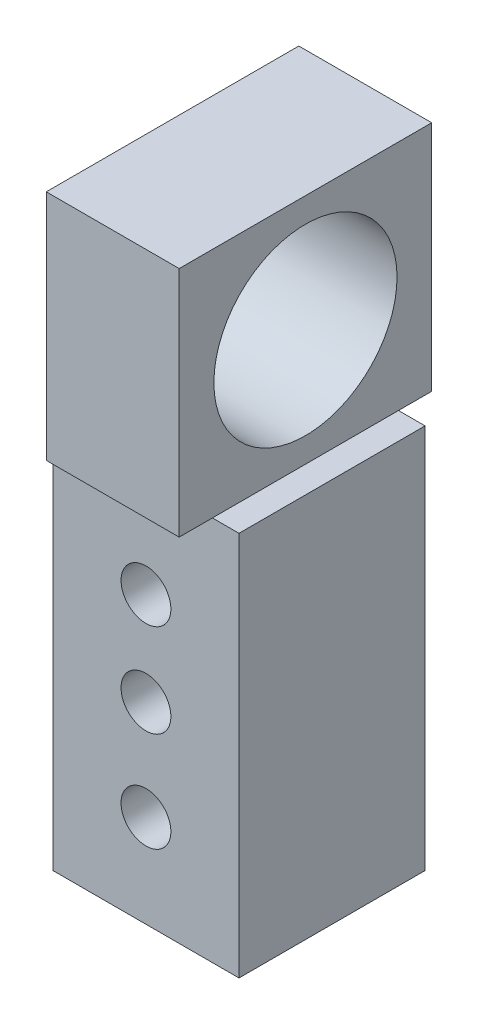
from build123d import *

# Parameters (mm, degrees)
SKETCH1_W           = 35.56
SKETCH1_H           = 35.56
BOSS_EXTRUDE1_DEPTH = 73.5965
SKETCH2_R           = 4.7625
CUT_EXTRUDE1_DEPTH  = 84.648591215
SKETCH3_W           = 25.4
SKETCH3_H           = 35.56
BOSS_EXTRUDE2_DEPTH = 44.45
SKETCH5_W           = 25.4
SKETCH5_H           = 44.45
BOSS_EXTRUDE3_DEPTH = 6.35
SKETCH6_W           = 25.4
SKETCH6_H           = 44.45
BOSS_EXTRUDE4_DEPTH = 6.35
SKETCH4_R           = 17.500000052
CUT_EXTRUDE2_DEPTH  = 84.232998938


with BuildPart() as part:
    # Sketch1 → Boss-Extrude1 (new body)
    with BuildSketch(Plane(origin=(0, 0, 0), x_dir=(1, 0, 0), z_dir=(0, 1, 0))):
        Rectangle(SKETCH1_W, SKETCH1_H)
    extrude(amount=-BOSS_EXTRUDE1_DEPTH)

    # Sketch2 → Cut-Extrude1 (cut, through all)
    with BuildSketch(Plane.XY.offset(17.78)):
        with Locations((0, -19.05)):
            Circle(SKETCH2_R)
        with Locations((0, -36.83)):
            Circle(SKETCH2_R)
        with Locations((0, -55.88)):
            Circle(SKETCH2_R)
    extrude(amount=-CUT_EXTRUDE1_DEPTH, mode=Mode.SUBTRACT)

    # Sketch3 → Boss-Extrude2 (add)
    with BuildSketch(Plane(origin=(0, 0, 0), x_dir=(1, 0, 0), z_dir=(0, 1, 0))):
        Rectangle(SKETCH3_W, SKETCH3_H)
    extrude(amount=BOSS_EXTRUDE2_DEPTH)

    # Sketch5 → Boss-Extrude3 (add)
    with BuildSketch(Plane.XY.offset(17.78)):
        with Locations((0, 22.225)):
            Rectangle(SKETCH5_W, SKETCH5_H)
    extrude(amount=BOSS_EXTRUDE3_DEPTH)

    # Sketch6 → Boss-Extrude4 (add)
    with BuildSketch(Plane(origin=(0, 0, -17.78), x_dir=(-1, 0, 0), z_dir=(0, 0, -1))):
        with Locations((0, 22.225)):
            Rectangle(SKETCH6_W, SKETCH6_H)
    extrude(amount=BOSS_EXTRUDE4_DEPTH)

    # Sketch4 → Cut-Extrude2 (cut, through all)
    with BuildSketch(Plane(origin=(12.7, 0, 0), x_dir=(0, 0, -1), z_dir=(1, 0, 0))):
        with Locations((0, 22.225)):
            Circle(SKETCH4_R)
    extrude(amount=-CUT_EXTRUDE2_DEPTH, mode=Mode.SUBTRACT)


solid = part.part
